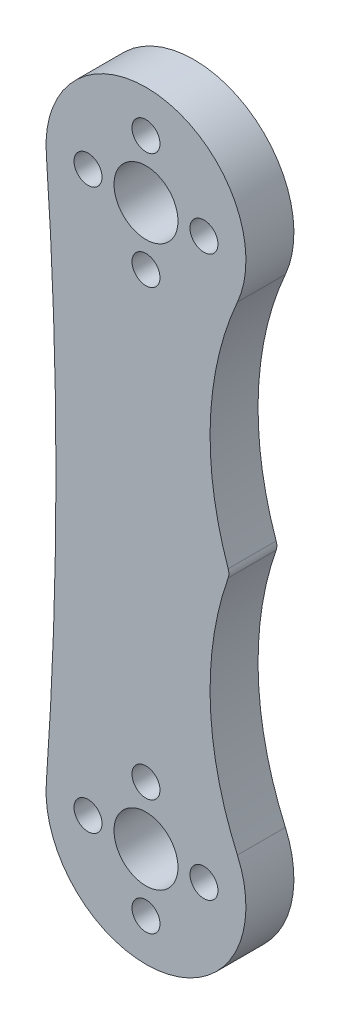
from build123d import *

# Parameters (mm, degrees)
SKETCH1_R           = 12.5
SKETCH1_R_2         = 1.5
BOSS_EXTRUDE1_DEPTH = 6
SKETCH2_R           = 4
SKETCH2_R_2         = 1.75
CUT_EXTRUDE1_DEPTH  = 84.657037959


with BuildPart() as part:
    # Sketch1 → Boss-Extrude1 (new body)
    with BuildSketch(Plane.XY):
        with BuildLine():
            ThreePointArc((-12.468548805, 0.886166287), (-2.14802756, 12.314056099), (11.432131685, 5.05533037))
            ThreePointArc((11.432131685, 5.05533037), (8.045519539, 19.668908158), (10.280253267, 34.502375816))
            ThreePointArc((10.280253267, 34.502375816), (7.365201971, 34.999999986), (10.280253258, 35.497624211))
            ThreePointArc((10.280253258, 35.497624211), (8.045519539, 50.331091856), (11.432131685, 64.944669631))
            ThreePointArc((11.432131685, 64.944669631), (-2.148028371, 57.685944043), (-12.468548922, 69.113835355))
            ThreePointArc((-12.468548922, 69.113835355), (-11.560587189, 52.067656989), (-11.257806268, 35))
            ThreePointArc((-11.257806268, 35), (-11.56058716, 17.932343833), (-12.468548805, 0.886166287))
        make_face()
        with Locations((0, 70)):
            Circle(SKETCH1_R)
        with Locations((8.865201971, 35)):
            Circle(SKETCH1_R_2)
        Circle(SKETCH1_R)
    extrude(amount=BOSS_EXTRUDE1_DEPTH)

    # Sketch2 → Cut-Extrude1 (cut, through all)
    with BuildSketch(Plane.XY.offset(6)):
        with Locations((0, 70)):
            Circle(SKETCH2_R)
        Circle(SKETCH2_R)
        with Locations((0, 7.25)):
            Circle(SKETCH2_R_2)
        with Locations((7.25, 0)):
            Circle(SKETCH2_R_2)
        with Locations((0, -7.25)):
            Circle(SKETCH2_R_2)
        with Locations((-7.25, 0)):
            Circle(SKETCH2_R_2)
        with Locations((0, 77.25)):
            Circle(SKETCH2_R_2)
        with Locations((7.25, 70)):
            Circle(SKETCH2_R_2)
        with Locations((0, 62.75)):
            Circle(SKETCH2_R_2)
        with Locations((-7.25, 70)):
            Circle(SKETCH2_R_2)
    extrude(amount=-CUT_EXTRUDE1_DEPTH, mode=Mode.SUBTRACT)


solid = part.part
